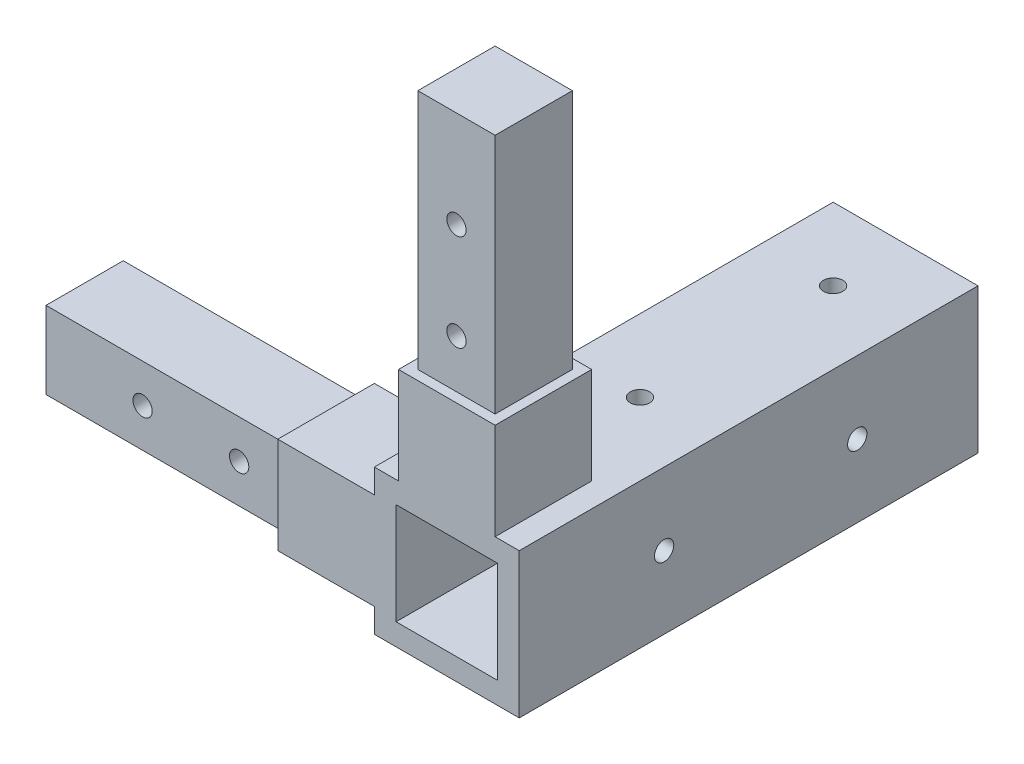
from build123d import *

# Parameters (mm, degrees)
SKETCH1_W           = 100
SKETCH1_H           = 100
BOSS_EXTRUDE1_DEPTH = 100
CUT_EXTRUDE16_DEPTH = 70
SKETCH8_W           = 70
SKETCH8_H           = 70
CUT_EXTRUDE17_DEPTH = 30
SKETCH9_W           = 21
SKETCH9_H           = 21
CUT_EXTRUDE20_DEPTH = 100
SKETCH10_W          = 30
SKETCH10_H          = 30
SKETCH10_W_2        = 16
SKETCH10_H_2        = 16
CUT_EXTRUDE21_DEPTH = 50
SKETCH11_W          = 30
SKETCH11_H          = 30
SKETCH11_W_2        = 20
SKETCH11_H_2        = 20
CUT_EXTRUDE22_DEPTH = 20
SKETCH12_W          = 30
SKETCH12_H          = 30
SKETCH12_W_2        = 20
SKETCH12_H_2        = 20
CUT_EXTRUDE23_DEPTH = 70
SKETCH13_W          = 20
SKETCH13_H          = 20
SKETCH13_W_2        = 16
SKETCH13_H_2        = 16
CUT_EXTRUDE24_DEPTH = 50
SKETCH15_R          = 2
CUT_EXTRUDE25_DEPTH = 30
SKETCH16_R          = 2
CUT_EXTRUDE26_DEPTH = 30
SKETCH17_R          = 2
CUT_EXTRUDE27_DEPTH = 16
SKETCH18_R          = 2
CUT_EXTRUDE29_DEPTH = 16
SKETCH19_W          = 30
SKETCH19_H          = 30
CUT_EXTRUDE30_DEPTH = 5


with BuildPart() as part:
    # Sketch1 → Boss-Extrude1 (new body)
    with BuildSketch(Plane.XY):
        Rectangle(SKETCH1_W, SKETCH1_H)
    extrude(amount=-BOSS_EXTRUDE1_DEPTH)

    # Sketch5 → Cut-Extrude16 (cut)
    with BuildSketch(Plane(origin=(0, 0, -100), x_dir=(-1, 0, 0), z_dir=(0, 0, -1))):
        Polygon((50, -50), (50, 50), (-50, 50), (-50, -20), (-20, -20), (-20, -50), align=None)
    extrude(amount=-CUT_EXTRUDE16_DEPTH, mode=Mode.SUBTRACT)

    # Sketch8 → Cut-Extrude17 (cut)
    with BuildSketch(Plane(origin=(0, 0, -30), x_dir=(-1, 0, 0), z_dir=(0, 0, -1))):
        with Locations((15, 15)):
            Rectangle(SKETCH8_W, SKETCH8_H)
    extrude(amount=-CUT_EXTRUDE17_DEPTH, mode=Mode.SUBTRACT)

    # Sketch9 → Cut-Extrude20 (cut)
    with BuildSketch(Plane(origin=(0, 0, -100), x_dir=(-1, 0, 0), z_dir=(0, 0, -1))):
        with Locations((-35, -35)):
            Rectangle(SKETCH9_W, SKETCH9_H)
    extrude(amount=-CUT_EXTRUDE20_DEPTH, mode=Mode.SUBTRACT)

    # Sketch10 → Cut-Extrude21 (cut)
    with BuildSketch(Plane.ZY.offset(50)):
        with Locations((-15, -35)):
            Rectangle(SKETCH10_W, SKETCH10_H)
        with Locations((-15, -35)):
            Rectangle(SKETCH10_W_2, SKETCH10_H_2, mode=Mode.SUBTRACT)
    extrude(amount=-CUT_EXTRUDE21_DEPTH, mode=Mode.SUBTRACT)

    # Sketch11 → Cut-Extrude22 (cut)
    with BuildSketch(Plane.ZY):
        with Locations((-15, -35)):
            Rectangle(SKETCH11_W, SKETCH11_H)
        with Locations((-15, -35)):
            Rectangle(SKETCH11_W_2, SKETCH11_H_2, mode=Mode.SUBTRACT)
    extrude(amount=-CUT_EXTRUDE22_DEPTH, mode=Mode.SUBTRACT)

    # Sketch12 → Cut-Extrude23 (cut)
    with BuildSketch(Plane(origin=(0, 50, 0), x_dir=(1, 0, 0), z_dir=(0, 1, 0))):
        with Locations((35, 15)):
            Rectangle(SKETCH12_W, SKETCH12_H)
        with Locations((35, 15)):
            Rectangle(SKETCH12_W_2, SKETCH12_H_2, mode=Mode.SUBTRACT)
    extrude(amount=-CUT_EXTRUDE23_DEPTH, mode=Mode.SUBTRACT)

    # Sketch13 → Cut-Extrude24 (cut)
    with BuildSketch(Plane(origin=(0, 50, 0), x_dir=(1, 0, 0), z_dir=(0, 1, 0))):
        with Locations((35, 15)):
            Rectangle(SKETCH13_W, SKETCH13_H)
        with Locations((35, 15)):
            Rectangle(SKETCH13_W_2, SKETCH13_H_2, mode=Mode.SUBTRACT)
    extrude(amount=-CUT_EXTRUDE24_DEPTH, mode=Mode.SUBTRACT)

    # Sketch15 → Cut-Extrude25 (cut)
    with BuildSketch(Plane(origin=(0, -20, 0), x_dir=(1, 0, 0), z_dir=(0, 1, 0))):
        with Locations(Location((35, 85, 0), (0, 0, 270))):
            Circle(SKETCH15_R)
        with Locations(Location((35, 45, 0), (0, 0, 270))):
            Circle(SKETCH15_R)
    extrude(amount=-CUT_EXTRUDE25_DEPTH, mode=Mode.SUBTRACT)

    # Sketch16 → Cut-Extrude26 (cut)
    with BuildSketch(Plane(origin=(50, 0, 0), x_dir=(0, 0, -1), z_dir=(1, 0, 0))):
        with Locations((75, -35)):
            Circle(SKETCH16_R)
        with Locations((35, -35)):
            Circle(SKETCH16_R)
    extrude(amount=-CUT_EXTRUDE26_DEPTH, mode=Mode.SUBTRACT)

    # Sketch17 → Cut-Extrude27 (cut)
    with BuildSketch(Plane(origin=(0, 0, -23), x_dir=(-1, 0, 0), z_dir=(0, 0, -1))):
        with Locations((-35, 30)):
            Circle(SKETCH17_R)
        with Locations((-35, 10)):
            Circle(SKETCH17_R)
    extrude(amount=-CUT_EXTRUDE27_DEPTH, mode=Mode.SUBTRACT)

    # Sketch18 → Cut-Extrude29 (cut)
    with BuildSketch(Plane(origin=(0, 0, -23), x_dir=(-1, 0, 0), z_dir=(0, 0, -1))):
        with Locations((30, -35)):
            Circle(SKETCH18_R)
        with Locations((10, -35)):
            Circle(SKETCH18_R)
    extrude(amount=-CUT_EXTRUDE29_DEPTH, mode=Mode.SUBTRACT)

    # Sketch19 → Cut-Extrude30 (cut)
    with BuildSketch(Plane.XY):
        with Locations((35, -35)):
            Rectangle(SKETCH19_W, SKETCH19_H)
    extrude(amount=-CUT_EXTRUDE30_DEPTH, mode=Mode.SUBTRACT)


solid = part.part
